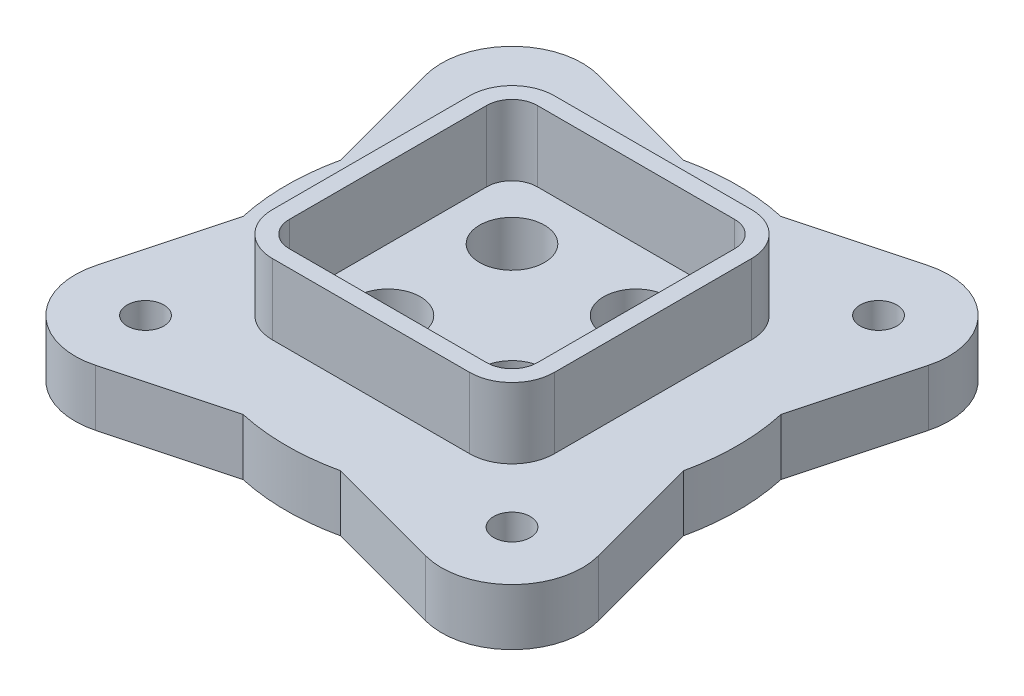
from build123d import *

# Parameters (mm, degrees)
SKETCH1_R             = 6.5
BOSS_EXTRUDE1_DEPTH   = 20
SKETCH1_R_2           = 11.5
BOSS_EXTRUDE1_2_DEPTH = 20
BOSS_EXTRUDE2_DEPTH   = 45
SKETCH2_R             = 72.5
SKETCH2_R_2           = 52.5
CUT_EXTRUDE1_DEPTH    = 3


with BuildPart() as part:
    # Sketch1 → Boss-Extrude1 (new body)
    with BuildSketch(Plane(origin=(0, 0, 0), x_dir=(1, 0, 0), z_dir=(0, 1, 0))):
        with BuildLine():
            Line((58.529523872, 89.148145657), (17.312897978, 78.104184034))
            ThreePointArc((17.312897978, 78.104184034), (0, 80), (-17.312897978, 78.104184034))
            Line((-17.312897978, 78.104184034), (-58.529523872, 89.148145657))
            ThreePointArc((-58.529523872, 89.148145657), (-82.67766953, 82.67766953), (-89.148145657, 58.529523872))
            Line((-89.148145657, 58.529523872), (-78.104184034, 17.312897978))
            ThreePointArc((-78.104184034, 17.312897978), (-80, 0), (-78.104184034, -17.312897978))
            Line((-78.104184034, -17.312897978), (-89.148145657, -58.529523872))
            ThreePointArc((-89.148145657, -58.529523872), (-82.67766953, -82.67766953), (-58.529523872, -89.148145657))
            Line((-58.529523872, -89.148145657), (-17.312897978, -78.104184034))
            ThreePointArc((-17.312897978, -78.104184034), (0, -80), (17.312897978, -78.104184034))
            Line((17.312897978, -78.104184034), (58.529523872, -89.148145657))
            ThreePointArc((58.529523872, -89.148145657), (82.67766953, -82.67766953), (89.148145657, -58.529523872))
            Line((89.148145657, -58.529523872), (78.104184034, -17.312897978))
            ThreePointArc((78.104184034, -17.312897978), (80, 0), (78.104184034, 17.312897978))
            Line((78.104184034, 17.312897978), (89.148145657, 58.529523872))
            ThreePointArc((89.148145657, 58.529523872), (82.67766953, 82.67766953), (58.529523872, 89.148145657))
        make_face()
        with Locations((-65, -65)):
            Circle(SKETCH1_R, mode=Mode.SUBTRACT)
        with Locations((65, -65)):
            Circle(SKETCH1_R, mode=Mode.SUBTRACT)
        with Locations((-65, 65)):
            Circle(SKETCH1_R, mode=Mode.SUBTRACT)
        with BuildLine():
            Line((35, -50), (-35, -50))
            ThreePointArc((-35, -50), (-45.606601718, -45.606601718), (-50, -35))
            Line((-50, -35), (-50, 35))
            ThreePointArc((-50, 35), (-45.606601718, 45.606601718), (-35, 50))
            Line((-35, 50), (35, 50))
            ThreePointArc((35, 50), (45.606601718, 45.606601718), (50, 35))
            Line((50, 35), (50, -35))
            ThreePointArc((50, -35), (45.606601718, -45.606601718), (35, -50))
        make_face(mode=Mode.SUBTRACT)
        with Locations((65, 65)):
            Circle(SKETCH1_R, mode=Mode.SUBTRACT)
    extrude(amount=BOSS_EXTRUDE1_DEPTH)



with BuildPart() as body_2:
    # Sketch1 → Boss-Extrude1 2 (new body)
    with BuildSketch(Plane(origin=(0, 0, 0), x_dir=(1, 0, 0), z_dir=(0, 1, 0))):
        with BuildLine():
            Line((35, 44), (-35, 44))
            ThreePointArc((-35, 44), (-41.363961031, 41.363961031), (-44, 35))
            Line((-44, 35), (-44, -35))
            ThreePointArc((-44, -35), (-41.363961031, -41.363961031), (-35, -44))
            Line((-35, -44), (35, -44))
            ThreePointArc((35, -44), (41.363961031, -41.363961031), (44, -35))
            Line((44, -35), (44, 35))
            ThreePointArc((44, 35), (41.363961031, 41.363961031), (35, 44))
        make_face()
        with Locations((-22, -22)):
            Circle(SKETCH1_R_2, mode=Mode.SUBTRACT)
        with Locations((22, -22)):
            Circle(SKETCH1_R_2, mode=Mode.SUBTRACT)
        with Locations((-22, 22)):
            Circle(SKETCH1_R_2, mode=Mode.SUBTRACT)
        with Locations((22, 22)):
            Circle(SKETCH1_R_2, mode=Mode.SUBTRACT)
    extrude(amount=BOSS_EXTRUDE1_2_DEPTH)


with BuildPart() as part_1:
    add(part.part)

    add(body_2.part)  # Boss-Extrude2 merges body 2
    # Sketch1<3> → Boss-Extrude2 (add)
    with BuildSketch(Plane(origin=(0, 0, 0), x_dir=(1, 0, 0), z_dir=(0, 1, 0))):
        with BuildLine():
            ThreePointArc((-50, -35), (-45.606601718, -45.606601718), (-35, -50))
            Line((-35, -50), (35, -50))
            ThreePointArc((35, -50), (45.606601718, -45.606601718), (50, -35))
            Line((50, -35), (50, 35))
            ThreePointArc((50, 35), (45.606601718, 45.606601718), (35, 50))
            Line((35, 50), (-35, 50))
            ThreePointArc((-35, 50), (-45.606601718, 45.606601718), (-50, 35))
            Line((-50, 35), (-50, -35))
        make_face()
        with BuildLine():
            ThreePointArc((-44, 35), (-41.363961031, 41.363961031), (-35, 44))
            Line((-35, 44), (35, 44))
            ThreePointArc((35, 44), (41.363961031, 41.363961031), (44, 35))
            Line((44, 35), (44, -35))
            ThreePointArc((44, -35), (41.363961031, -41.363961031), (35, -44))
            Line((35, -44), (-35, -44))
            ThreePointArc((-35, -44), (-41.363961031, -41.363961031), (-44, -35))
            Line((-44, -35), (-44, 35))
        make_face(mode=Mode.SUBTRACT)
    extrude(amount=BOSS_EXTRUDE2_DEPTH)

    # Sketch2 → Cut-Extrude1 (cut)
    with BuildSketch(Plane.XZ):
        Circle(SKETCH2_R)
        Circle(SKETCH2_R_2, mode=Mode.SUBTRACT)
    extrude(amount=-CUT_EXTRUDE1_DEPTH, mode=Mode.SUBTRACT)


solid = part_1.part
